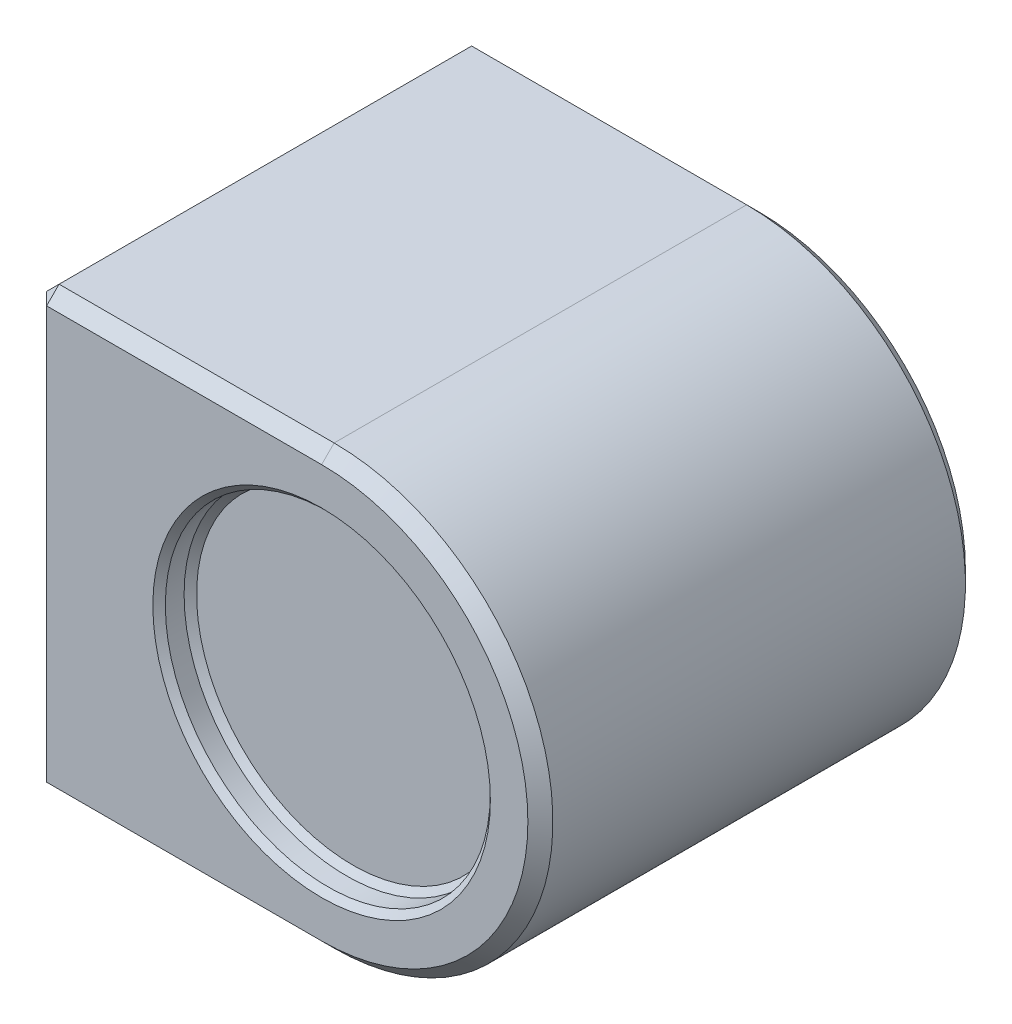
from build123d import *

# Parameters (mm, degrees)
BOSS_EXTRUDE1_DEPTH = 70
SKETCH4_R           = 25
BOSS_EXTRUDE2_DEPTH = 5
CHAMFER1_SIZE       = 2
SKETCH5_R           = 26
CUT_EXTRUDE1_DEPTH  = 5
CHAMFER3_SIZE       = 1


with BuildPart() as part:
    # Sketch3 → Boss-Extrude1 (new body)
    with BuildSketch(Plane.XY):
        with BuildLine():
            Line((0, 35), (46, 35))
            Line((46, 35), (46, -35))
            Line((46, -35), (0, -35))
            ThreePointArc((0, -35), (-35, 0), (0, 35))
        make_face()
    extrude(amount=BOSS_EXTRUDE1_DEPTH)

    # Sketch4 → Boss-Extrude2 (add)
    with BuildSketch(Plane(origin=(46, 0, 0), x_dir=(0, 0, -1), z_dir=(1, 0, 0))):
        with Locations(Location((-38, 0, 0), (0, 0, 180))):
            Circle(SKETCH4_R)
    extrude(amount=BOSS_EXTRUDE2_DEPTH)

    # Chamfer1
    chamfer1_edges = [part.edges().sort_by_distance(p)[0] for p in [
        (46, 0, 70),
        (23, 35, 70),
        (-35, 0, 70),
        (23, 35, 0),
        (46, 0, 0),
        (23, -35, 0),
        (-35, 0, 0),
        (23, -35, 70),
        (46, 35, 35),
        (46, -35, 35),
    ]]
    chamfer(chamfer1_edges, length=CHAMFER1_SIZE)

    # Sketch5 → Cut-Extrude1 (cut)
    with BuildSketch(Plane(origin=(0, 0, 0), x_dir=(-1, 0, 0), z_dir=(0, 0, -1))):
        Circle(SKETCH5_R)
    extrude(amount=-CUT_EXTRUDE1_DEPTH, mode=Mode.SUBTRACT)

    # Chamfer3
    chamfer3_edges = [part.edges().sort_by_distance(p)[0] for p in [
        (46, 0, 13),
        (51, 0, 13),
        (26, 0, 5),
        (26, 0, 0),
    ]]
    chamfer(chamfer3_edges, length=CHAMFER3_SIZE)


with BuildPart() as body_2:
    # Mirror1: mirrored copy
    add(part.part.mirror(Plane(origin=(0, 0, 0), x_dir=(0, 0, 1), z_dir=(1, 0, 0))))


with BuildPart() as body_2_2:
    # Mirror2: mirrored copy
    add(body_2.part.mirror(Plane.XY))


solid = body_2_2.part
